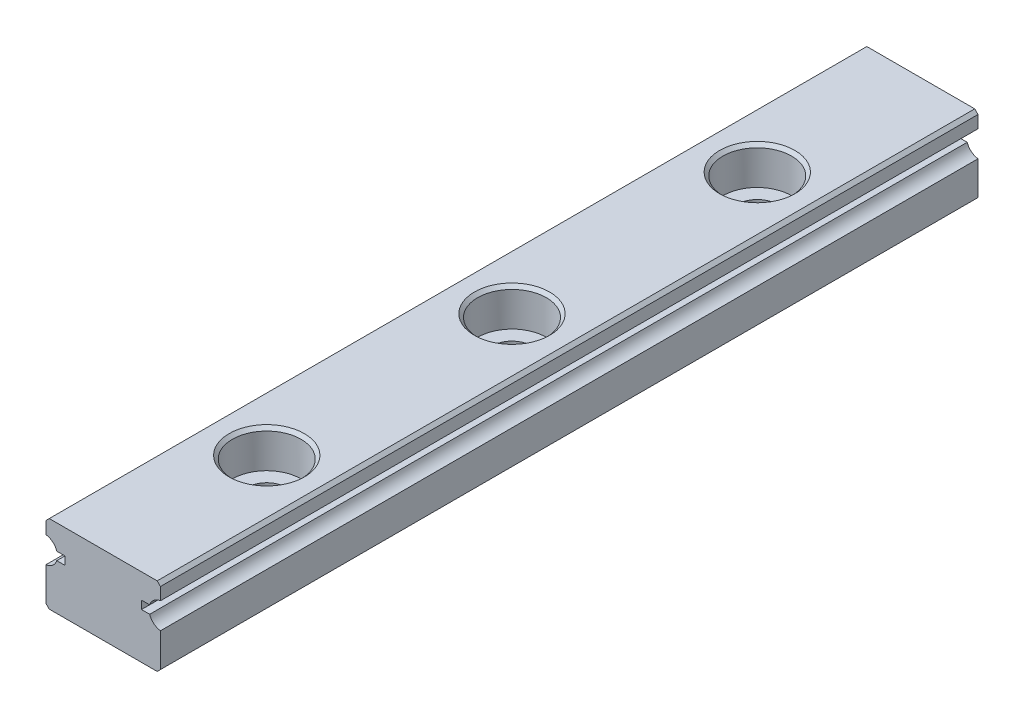
from build123d import *

# Parameters (mm, degrees)
EXTRUDE1_DEPTH             = 50
EXTRUDE2_REACH             = 52.352
SKETCH2_R                  = 1.2
SKETCH_R                   = 2.1
SKETCH_R_2                 = 1.2
EXTRUDE4_DEPTH             = 2.3
CHAMFER1_SIZE              = 0.2
LPATTERN1_COUNT            = 3
LPATTERN1_PITCH            = 15
CHAMFER1_OF_LPATTERN1_SIZE = 0.2


with BuildPart() as part:
    # Sketch1 → Extrude1 (new body)
    with BuildSketch(Plane.XY):
        with BuildLine():
            Line((-3.3, -2.4), (3.3, -2.4))
            Line((3.3, -2.4), (3.5, -2.2))
            Line((3.5, -2.2), (3.5, -0.143725393))
            ThreePointArc((3.5, -0.143725393), (3.091294745, 0.032570681), (2.840065792, 0.4))
            Line((2.840065792, 0.4), (2.340065792, 0.4))
            Line((2.340065792, 0.4), (2.340065792, 0.9))
            Line((2.340065792, 0.9), (2.840065792, 0.9))
            ThreePointArc((2.840065792, 0.9), (3.091294745, 1.267429319), (3.5, 1.443725393))
            Line((3.5, 1.443725393), (3.5, 2.2))
            Line((3.5, 2.2), (3.3, 2.4))
            Line((3.3, 2.4), (-3.3, 2.4))
            Line((-3.3, 2.4), (-3.5, 2.2))
            Line((-3.5, 2.2), (-3.5, 1.443725393))
            ThreePointArc((-3.5, 1.443725393), (-3.091294745, 1.267429319), (-2.840065792, 0.9))
            Line((-2.840065792, 0.9), (-2.340065792, 0.9))
            Line((-2.340065792, 0.9), (-2.340065792, 0.4))
            Line((-2.340065792, 0.4), (-2.840065792, 0.4))
            ThreePointArc((-2.840065792, 0.4), (-3.091294745, 0.032570681), (-3.5, -0.143725393))
            Line((-3.5, -0.143725393), (-3.5, -2.2))
            Line((-3.5, -2.2), (-3.3, -2.4))
        make_face()
    extrude(amount=EXTRUDE1_DEPTH)

    # Sketch2 → Extrude2 (cut, up to next)
    with BuildSketch(Plane(origin=(0, 2.4, 0), x_dir=(1, 0, 0), z_dir=(0, 1, 0)), mode=Mode.PRIVATE) as extrude2_sk1:
        with Locations((0, -10)):
            Circle(SKETCH2_R)
    extrude2_tool1 = extrude(extrude2_sk1.sketch, amount=-EXTRUDE2_REACH, mode=Mode.PRIVATE) & part.part
    extrude2 = extrude2_tool1.solids().sort_by_distance((0, 2.4, 10))[0]
    add(extrude2, mode=Mode.SUBTRACT)

    # Sketch → Extrude4 (cut)
    with BuildSketch(Plane(origin=(0, 2.4, 0), x_dir=(1, 0, 0), z_dir=(0, 1, 0))):
        with Locations((0, -10)):
            Circle(SKETCH_R)
        with Locations((0, -10)):
            Circle(SKETCH_R_2, mode=Mode.SUBTRACT)
    extrude4 = extrude(amount=-EXTRUDE4_DEPTH, mode=Mode.SUBTRACT)

    # Chamfer1
    chamfer1_edges = [part.edges().sort_by_distance(p)[0] for p in [
        (-1.2, -2.4, 10),
        (-2.1, 2.4, 10),
    ]]
    chamfer(chamfer1_edges, length=CHAMFER1_SIZE)

    # LPattern1: Extrude2, Extrude4 ×3
    with Locations(*[(0, 0, i * LPATTERN1_PITCH) for i in range(1, LPATTERN1_COUNT)]):
        add(extrude2, mode=Mode.SUBTRACT)
        add(extrude4, mode=Mode.SUBTRACT)

    # Chamfer1 of LPattern1
    chamfer1_of_lpattern1_edges = [part.edges().sort_by_distance(p)[0] for p in [
        (-1.2, -2.4, 25),
        (-2.1, 2.4, 25),
        (-1.2, -2.4, 40),
        (-2.1, 2.4, 40),
    ]]
    chamfer(chamfer1_of_lpattern1_edges, length=CHAMFER1_OF_LPATTERN1_SIZE)


solid = part.part
